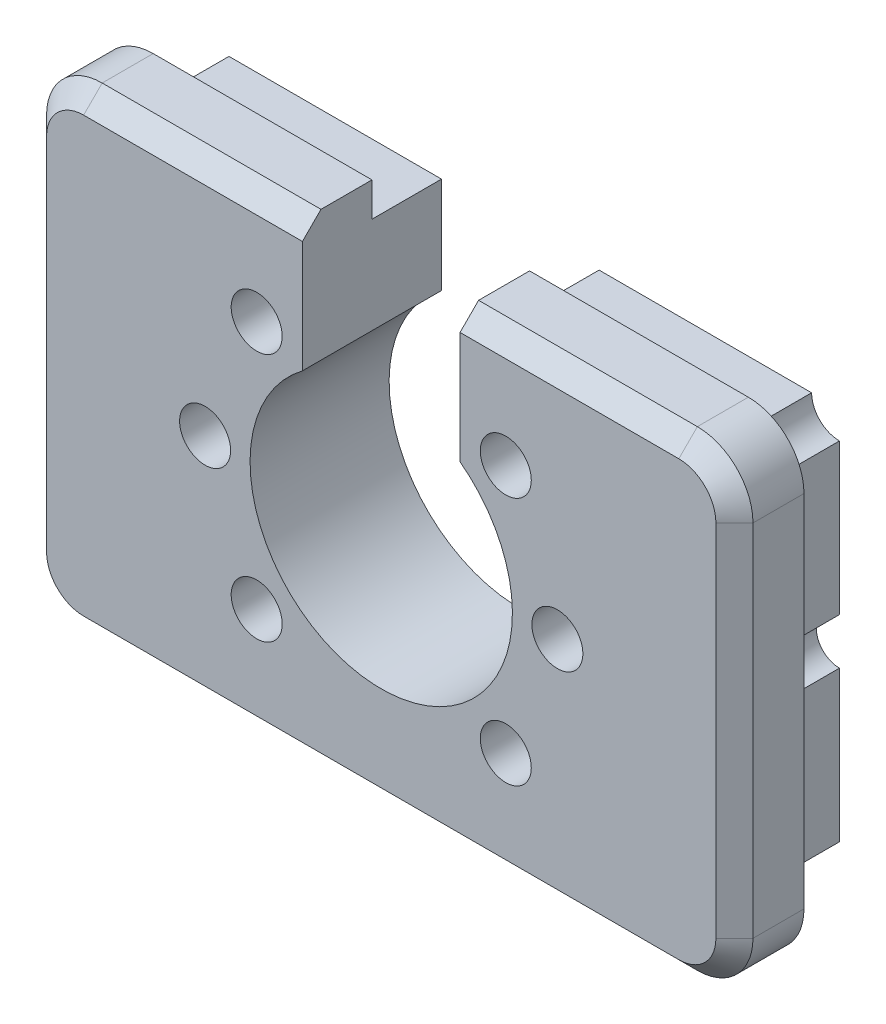
from build123d import *

# Parameters (mm, degrees)
SKETCH1_W           = 76.2
SKETCH1_H           = 50.8
BOSS_EXTRUDE1_DEPTH = 7.5
SKETCH2_W           = 68.85
SKETCH2_H           = 43.45
BOSS_EXTRUDE2_DEPTH = 7.5
SKETCH3_R           = 2.75
CUT_EXTRUDE1_DEPTH  = 49.184748624
FILLET1_R           = 6
SKETCH4_R           = 3
SKETCH4_R_2         = 2.5
CUT_EXTRUDE2_DEPTH  = 7.5
CHAMFER1_SIZE       = 2


with BuildPart() as part:
    # Sketch1 → Boss-Extrude1 (new body)
    with BuildSketch(Plane.XY):
        Rectangle(SKETCH1_W, SKETCH1_H)
    extrude(amount=-BOSS_EXTRUDE1_DEPTH)

    # Sketch2 → Boss-Extrude2 (add)
    with BuildSketch(Plane(origin=(0, 0, -7.5), x_dir=(-1, 0, 0), z_dir=(0, 0, -1))):
        Rectangle(SKETCH2_W, SKETCH2_H)
    extrude(amount=BOSS_EXTRUDE2_DEPTH)

    # Sketch3 → Cut-Extrude1 (cut, through all)
    with BuildSketch(Plane.XY):
        with Locations((-19, 0)):
            Circle(SKETCH3_R)
        with Locations((-13.435028843, 13.435028843)):
            Circle(SKETCH3_R)
        with Locations((13.435028843, 13.435028843)):
            Circle(SKETCH3_R)
        with Locations((19, 0)):
            Circle(SKETCH3_R)
        with Locations((13.435028843, -13.435028843)):
            Circle(SKETCH3_R)
        with Locations((-13.435028843, -13.435028843)):
            Circle(SKETCH3_R)
        with BuildLine():
            Line((8.5, 11.312493094), (8.5, 25.4))
            Line((8.5, 25.4), (-8.5, 25.4))
            Line((-8.5, 25.4), (-8.5, 11.312493094))
            ThreePointArc((-8.5, 11.312493094), (0, -14.15), (8.5, 11.312493094))
        make_face()
    extrude(amount=-CUT_EXTRUDE1_DEPTH, mode=Mode.SUBTRACT)

    # Fillet1
    fillet1_edges = [part.edges().sort_by_distance(p)[0] for p in [
        (-38.1, 25.4, -3.75),
        (38.1, 25.4, -3.75),
        (38.1, -25.4, -3.75),
        (-38.1, -25.4, -3.75),
    ]]
    fillet(fillet1_edges, radius=FILLET1_R)

    # Sketch4 → Cut-Extrude2 (cut)
    with BuildSketch(Plane(origin=(0, 0, -15), x_dir=(-1, 0, 0), z_dir=(0, 0, -1))):
        with Locations((-34.425, 21.725)):
            Circle(SKETCH4_R)
        with Locations((-34.425, -21.725)):
            Circle(SKETCH4_R)
        with Locations((-34.425, 0)):
            Circle(SKETCH4_R_2)
        with Locations((0, -21.725)):
            Circle(SKETCH4_R_2)
        with Locations((34.425, -21.725)):
            Circle(SKETCH4_R)
        with Locations((34.425, 0)):
            Circle(SKETCH4_R_2)
        with Locations((34.425, 21.725)):
            Circle(SKETCH4_R)
    extrude(amount=-CUT_EXTRUDE2_DEPTH, mode=Mode.SUBTRACT)

    # Chamfer1
    chamfer1_edges = [part.edges().sort_by_distance(p)[0] for p in [
        (-20.3, 25.4, 0),
        (0, -25.4, 0),
        (-38.1, 0, 0),
        (38.1, 0, 0),
        (20.3, 25.4, 0),
        (36.342640687, 23.642640687, 0),
        (-36.342640687, 23.642640687, 0),
        (-36.342640687, -23.642640687, 0),
        (36.342640687, -23.642640687, 0),
    ]]
    chamfer(chamfer1_edges, length=CHAMFER1_SIZE)


solid = part.part
